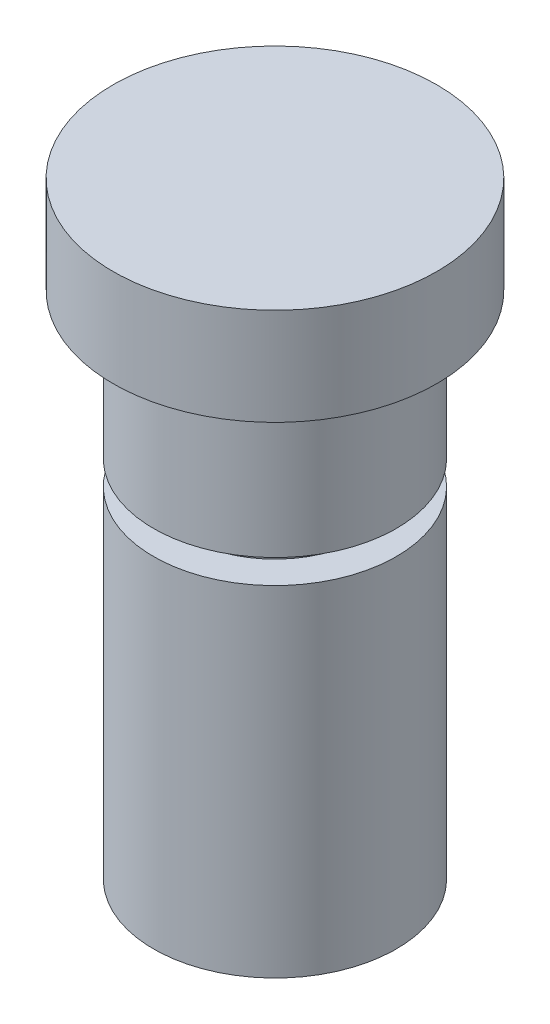
from build123d import *


with BuildPart() as part:
    # SK_EStop → EStop (revolve)
    with BuildSketch(Plane.XY, mode=Mode.PRIVATE) as estop_sk:
        Polygon((0, -45), (15, -45), (15, -3), (11, -3), (11, 0), (15, 0), (15, 18), (20, 18), (20, 30), (0, 30), align=None)
    revolve(estop_sk.sketch.rotate(Axis((0, -50, 0), (0, 1, 0)), 90), axis=Axis((0, -50, 0), (0, 1, 0)))


solid = part.part
